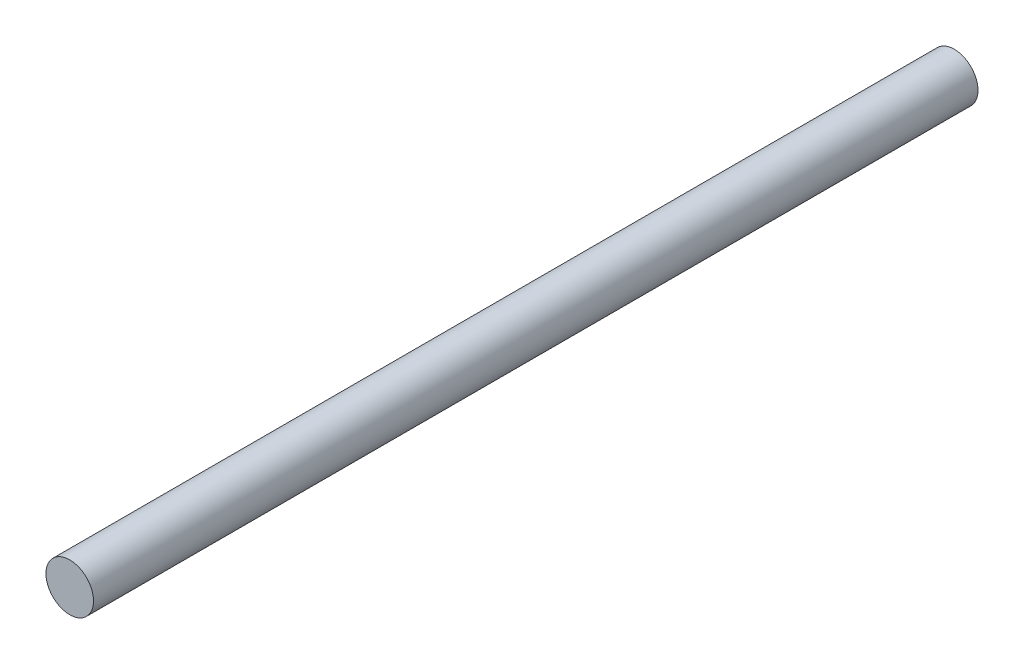
from build123d import *

# Parameters (mm, degrees)
SKETCH1_R           = 6.35
BOSS_EXTRUDE1_DEPTH = 236.22


with BuildPart() as part:
    # Sketch1 → Boss-Extrude1 (new body)
    with BuildSketch(Plane.XY):
        Circle(SKETCH1_R)
    extrude(amount=BOSS_EXTRUDE1_DEPTH)


solid = part.part
